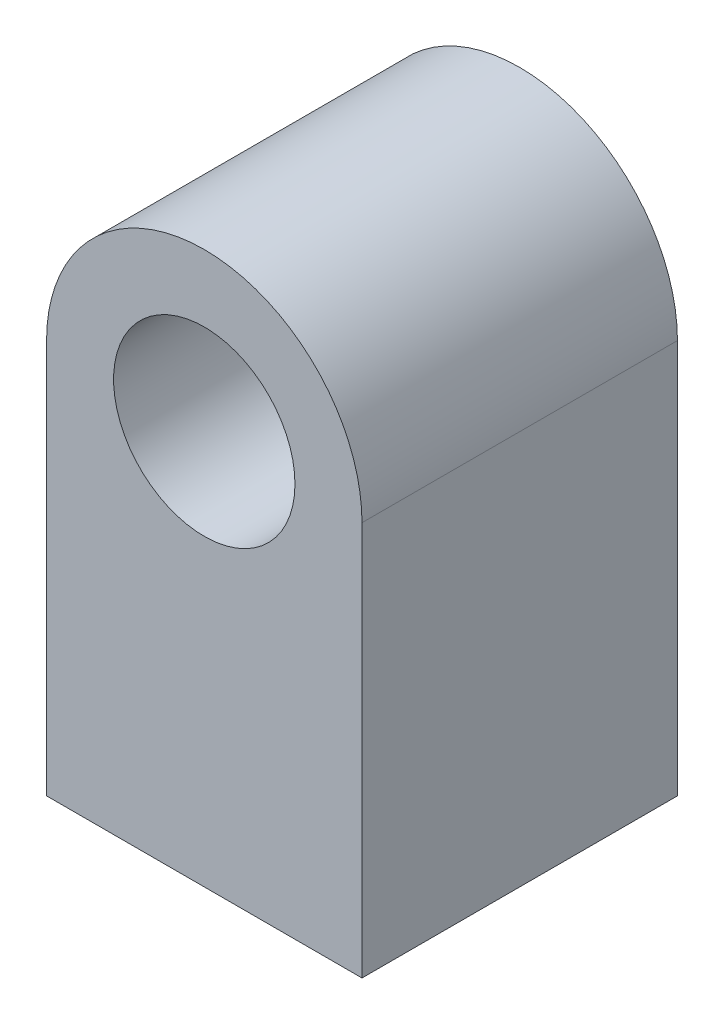
from build123d import *

# Parameters (mm, degrees)
SKETCH_1_R          = 1.15
EXTRUDE_1_DEPTH     = 4
SKETCH_2_R          = 1
CUT_EXTRUDE_1_DEPTH = 3.5


with BuildPart() as part:
    # 草图1 → 凸台-拉伸1 (new body)
    with BuildSketch(Plane.XY):
        with BuildLine():
            Line((2, 0), (2, -5))
            Line((2, -5), (-2, -5))
            Line((-2, -5), (-2, 0))
            ThreePointArc((-2, 0), (0, 2), (2, 0))
        make_face()
        Circle(SKETCH_1_R, mode=Mode.SUBTRACT)
    extrude(amount=EXTRUDE_1_DEPTH)

    # 草图2 → 切除-拉伸1 (cut)
    with BuildSketch(Plane.XZ.offset(5)):
        with Locations(Location((0, 2, 0), (0, 0, 270))):
            Circle(SKETCH_2_R)
    extrude(amount=-CUT_EXTRUDE_1_DEPTH, mode=Mode.SUBTRACT)


solid = part.part
